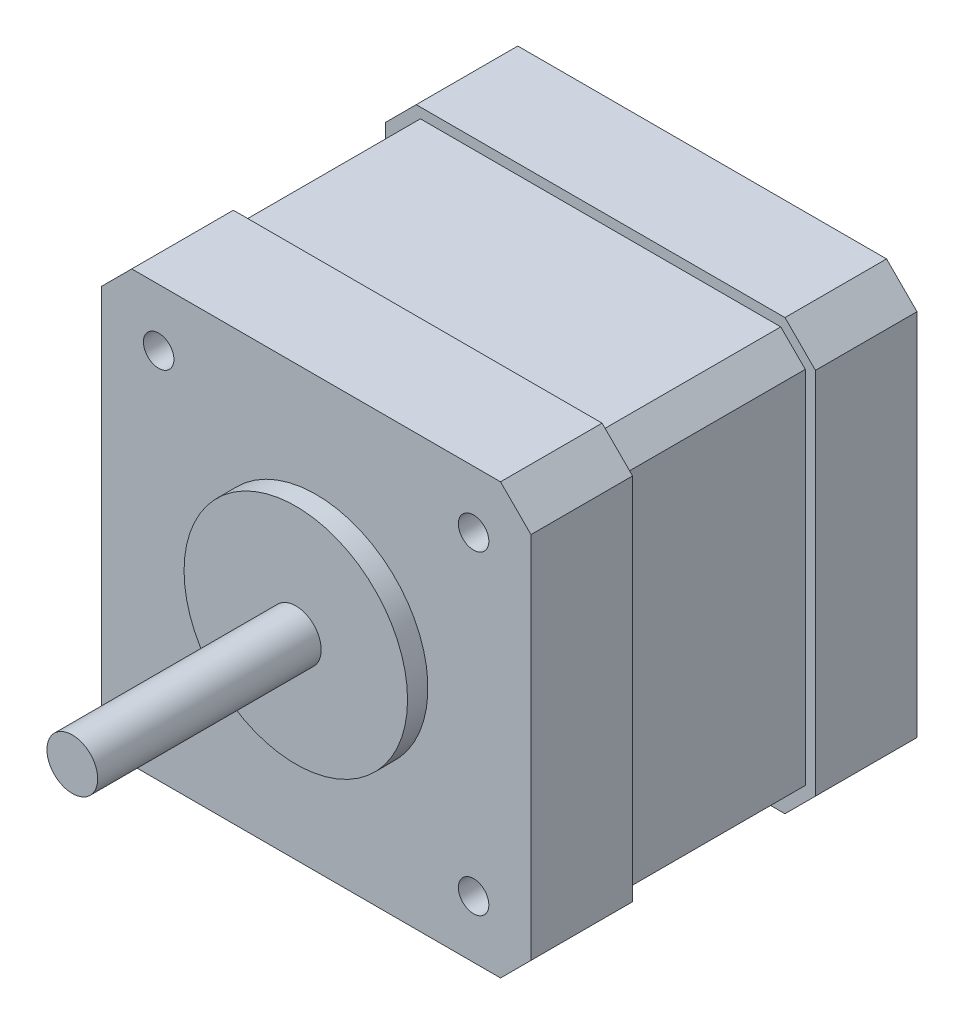
from build123d import *

# Parameters (mm, degrees)
EXTRUDE_1_DEPTH     = 10
SKETCH_2_R          = 11
EXTRUDE_2_DEPTH     = 2
SKETCH_3_R          = 2.5
EXTRUDE_3_DEPTH     = 22
EXTRUDE_4_DEPTH     = 18
EXTRUDE_5_DEPTH     = 10
SKETCH_4_R          = 1.5
CUT_EXTRUDE_1_DEPTH = 46.5
SKETCH_5_R          = 2.5
CUT_EXTRUDE_2_DEPTH = 1


with BuildPart() as part:
    # Эскиз1 → Бобышка-Вытянуть1 (new body)
    with BuildSketch(Plane.XY):
        Polygon((-32.767753805, -16.536194896), (-32.767753805, 19.763805104), (-29.767753805, 22.763805104), (6.532246195, 22.763805104), (9.532246195, 19.763805104), (9.532246195, -16.536194896), (6.532246195, -19.536194896), (-29.767753805, -19.536194896), align=None)
    extrude(amount=EXTRUDE_1_DEPTH)

    # Эскиз2 → Бобышка-Вытянуть2 (add)
    with BuildSketch(Plane.XY.offset(10)):
        with Locations(Location((-11.617753805, 1.613805104, 0), (0, 0, 180))):
            Circle(SKETCH_2_R)
    extrude(amount=EXTRUDE_2_DEPTH)

    # Эскиз3 → Бобышка-Вытянуть3 (add)
    with BuildSketch(Plane.XY.offset(12)):
        with Locations((-11.617753805, 1.613805104)):
            Circle(SKETCH_3_R)
    extrude(amount=EXTRUDE_3_DEPTH)

    # Эскиз6 → Бобышка-Вытянуть4 (add)
    with BuildSketch(Plane(origin=(0, 0, 0), x_dir=(-1, 0, 0), z_dir=(0, 0, -1))):
        Polygon((11.617753805, 21.763805104), (-6.118032632, 21.763805104), (-8.532246195, 19.349591542), (-8.532246195, -16.121981333), (-6.118032632, -18.536194896), (29.353540243, -18.536194896), (31.767753805, -16.121981333), (31.767753805, 19.349591542), (29.353540243, 21.763805104), align=None)
    extrude(amount=EXTRUDE_4_DEPTH)

    # Эскиз7 → Бобышка-Вытянуть5 (add)
    with BuildSketch(Plane.XY.offset(-18)):
        Polygon((-32.767753805, -16.536194896), (-32.767753805, 19.763805104), (-29.767753805, 22.763805104), (6.532246195, 22.763805104), (9.532246195, 19.763805104), (9.532246195, -16.536194896), (6.532246195, -19.536194896), (-29.767753805, -19.536194896), align=None)
    extrude(amount=-EXTRUDE_5_DEPTH)

    # Эскиз4 → Вырез-Вытянуть1 (cut)
    with BuildSketch(Plane.XY.offset(10)):
        with Locations((-27.117753805, 17.113805104)):
            Circle(SKETCH_4_R)
        with Locations((3.882246195, 17.113805104)):
            Circle(SKETCH_4_R)
        with Locations((3.882246195, -13.886194896)):
            Circle(SKETCH_4_R)
        with Locations((-27.117753805, -13.886194896)):
            Circle(SKETCH_4_R)
    extrude(amount=-CUT_EXTRUDE_1_DEPTH, mode=Mode.SUBTRACT)

    # Эскиз5 → Вырез-Вытянуть2 (cut)
    with BuildSketch(Plane(origin=(0, 0, -28), x_dir=(-1, 0, 0), z_dir=(0, 0, -1))):
        with Locations(Location((11.617753805, 1.613805104, 0), (0, 0, 180))):
            Circle(SKETCH_5_R)
    extrude(amount=-CUT_EXTRUDE_2_DEPTH, mode=Mode.SUBTRACT)


solid = part.part
